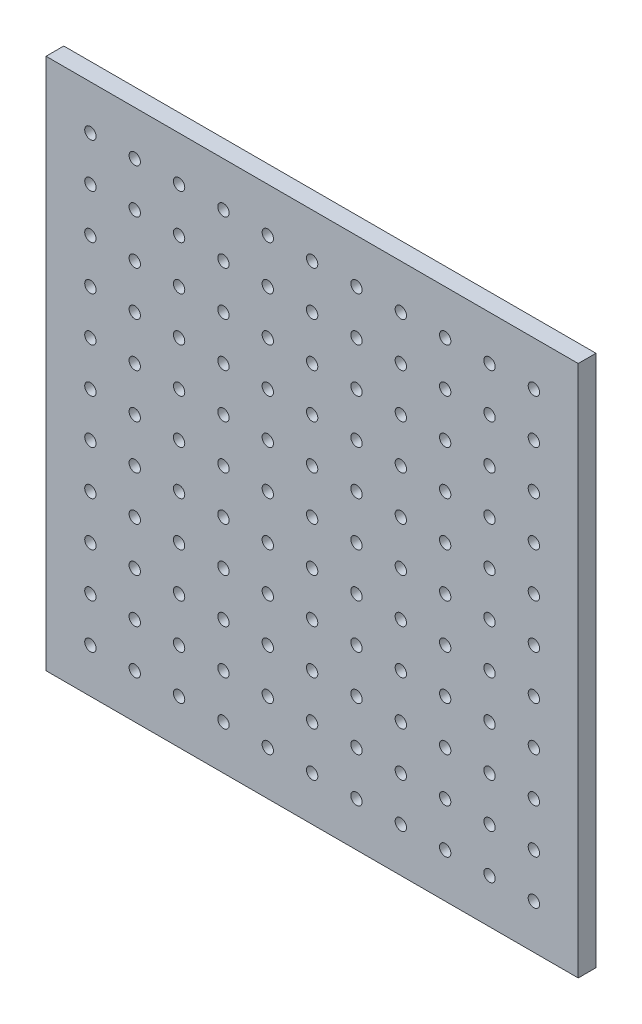
from build123d import *

# Parameters (mm, degrees)
SKETCH_1_W                         = 300
SKETCH_1_H                         = 300
EXTRUDE_1_DEPTH                    = 10
SKETCH_2_R                         = 3.2
CUT_EXTRUDE_1_DEPTH                = 213.367605816
PATTERN_LINEAR_1_COUNT             = 11
PATTERN_LINEAR_1_PITCH             = 25
PATTERN_LINEAR_2_COUNT             = 11
PATTERN_LINEAR_2_PITCH             = 25
PATTERN_LINEAR_2_COPY_1_SKETCH_R   = 3.2
PATTERN_LINEAR_2_COPY_1_DEPTH      = 213.367605816
PATTERN_LINEAR_2_COPY_2_SKETCH_R   = 3.2
PATTERN_LINEAR_2_COPY_2_DEPTH      = 213.367605816
PATTERN_LINEAR_2_COPY_3_SKETCH_R   = 3.2
PATTERN_LINEAR_2_COPY_3_DEPTH      = 213.367605816
PATTERN_LINEAR_2_COPY_4_SKETCH_R   = 3.2
PATTERN_LINEAR_2_COPY_4_DEPTH      = 213.367605816
PATTERN_LINEAR_2_COPY_5_SKETCH_R   = 3.2
PATTERN_LINEAR_2_COPY_5_DEPTH      = 213.367605816
PATTERN_LINEAR_2_COPY_6_SKETCH_R   = 3.2
PATTERN_LINEAR_2_COPY_6_DEPTH      = 213.367605816
PATTERN_LINEAR_2_COPY_7_SKETCH_R   = 3.2
PATTERN_LINEAR_2_COPY_7_DEPTH      = 213.367605816
PATTERN_LINEAR_2_COPY_8_SKETCH_R   = 3.2
PATTERN_LINEAR_2_COPY_8_DEPTH      = 213.367605816
PATTERN_LINEAR_2_COPY_9_SKETCH_R   = 3.2
PATTERN_LINEAR_2_COPY_9_DEPTH      = 213.367605816
PATTERN_LINEAR_2_COPY_10_SKETCH_R  = 3.2
PATTERN_LINEAR_2_COPY_10_DEPTH     = 213.367605816
PATTERN_LINEAR_2_COPY_11_SKETCH_R  = 3.2
PATTERN_LINEAR_2_COPY_11_DEPTH     = 213.367605816
PATTERN_LINEAR_2_COPY_12_SKETCH_R  = 3.2
PATTERN_LINEAR_2_COPY_12_DEPTH     = 213.367605816
PATTERN_LINEAR_2_COPY_13_SKETCH_R  = 3.2
PATTERN_LINEAR_2_COPY_13_DEPTH     = 213.367605816
PATTERN_LINEAR_2_COPY_14_SKETCH_R  = 3.2
PATTERN_LINEAR_2_COPY_14_DEPTH     = 213.367605816
PATTERN_LINEAR_2_COPY_15_SKETCH_R  = 3.2
PATTERN_LINEAR_2_COPY_15_DEPTH     = 213.367605816
PATTERN_LINEAR_2_COPY_16_SKETCH_R  = 3.2
PATTERN_LINEAR_2_COPY_16_DEPTH     = 213.367605816
PATTERN_LINEAR_2_COPY_17_SKETCH_R  = 3.2
PATTERN_LINEAR_2_COPY_17_DEPTH     = 213.367605816
PATTERN_LINEAR_2_COPY_18_SKETCH_R  = 3.2
PATTERN_LINEAR_2_COPY_18_DEPTH     = 213.367605816
PATTERN_LINEAR_2_COPY_19_SKETCH_R  = 3.2
PATTERN_LINEAR_2_COPY_19_DEPTH     = 213.367605816
PATTERN_LINEAR_2_COPY_20_SKETCH_R  = 3.2
PATTERN_LINEAR_2_COPY_20_DEPTH     = 213.367605816
PATTERN_LINEAR_2_COPY_21_SKETCH_R  = 3.2
PATTERN_LINEAR_2_COPY_21_DEPTH     = 213.367605816
PATTERN_LINEAR_2_COPY_22_SKETCH_R  = 3.2
PATTERN_LINEAR_2_COPY_22_DEPTH     = 213.367605816
PATTERN_LINEAR_2_COPY_23_SKETCH_R  = 3.2
PATTERN_LINEAR_2_COPY_23_DEPTH     = 213.367605816
PATTERN_LINEAR_2_COPY_24_SKETCH_R  = 3.2
PATTERN_LINEAR_2_COPY_24_DEPTH     = 213.367605816
PATTERN_LINEAR_2_COPY_25_SKETCH_R  = 3.2
PATTERN_LINEAR_2_COPY_25_DEPTH     = 213.367605816
PATTERN_LINEAR_2_COPY_26_SKETCH_R  = 3.2
PATTERN_LINEAR_2_COPY_26_DEPTH     = 213.367605816
PATTERN_LINEAR_2_COPY_27_SKETCH_R  = 3.2
PATTERN_LINEAR_2_COPY_27_DEPTH     = 213.367605816
PATTERN_LINEAR_2_COPY_28_SKETCH_R  = 3.2
PATTERN_LINEAR_2_COPY_28_DEPTH     = 213.367605816
PATTERN_LINEAR_2_COPY_29_SKETCH_R  = 3.2
PATTERN_LINEAR_2_COPY_29_DEPTH     = 213.367605816
PATTERN_LINEAR_2_COPY_30_SKETCH_R  = 3.2
PATTERN_LINEAR_2_COPY_30_DEPTH     = 213.367605816
PATTERN_LINEAR_2_COPY_31_SKETCH_R  = 3.2
PATTERN_LINEAR_2_COPY_31_DEPTH     = 213.367605816
PATTERN_LINEAR_2_COPY_32_SKETCH_R  = 3.2
PATTERN_LINEAR_2_COPY_32_DEPTH     = 213.367605816
PATTERN_LINEAR_2_COPY_33_SKETCH_R  = 3.2
PATTERN_LINEAR_2_COPY_33_DEPTH     = 213.367605816
PATTERN_LINEAR_2_COPY_34_SKETCH_R  = 3.2
PATTERN_LINEAR_2_COPY_34_DEPTH     = 213.367605816
PATTERN_LINEAR_2_COPY_35_SKETCH_R  = 3.2
PATTERN_LINEAR_2_COPY_35_DEPTH     = 213.367605816
PATTERN_LINEAR_2_COPY_36_SKETCH_R  = 3.2
PATTERN_LINEAR_2_COPY_36_DEPTH     = 213.367605816
PATTERN_LINEAR_2_COPY_37_SKETCH_R  = 3.2
PATTERN_LINEAR_2_COPY_37_DEPTH     = 213.367605816
PATTERN_LINEAR_2_COPY_38_SKETCH_R  = 3.2
PATTERN_LINEAR_2_COPY_38_DEPTH     = 213.367605816
PATTERN_LINEAR_2_COPY_39_SKETCH_R  = 3.2
PATTERN_LINEAR_2_COPY_39_DEPTH     = 213.367605816
PATTERN_LINEAR_2_COPY_40_SKETCH_R  = 3.2
PATTERN_LINEAR_2_COPY_40_DEPTH     = 213.367605816
PATTERN_LINEAR_2_COPY_41_SKETCH_R  = 3.2
PATTERN_LINEAR_2_COPY_41_DEPTH     = 213.367605816
PATTERN_LINEAR_2_COPY_42_SKETCH_R  = 3.2
PATTERN_LINEAR_2_COPY_42_DEPTH     = 213.367605816
PATTERN_LINEAR_2_COPY_43_SKETCH_R  = 3.2
PATTERN_LINEAR_2_COPY_43_DEPTH     = 213.367605816
PATTERN_LINEAR_2_COPY_44_SKETCH_R  = 3.2
PATTERN_LINEAR_2_COPY_44_DEPTH     = 213.367605816
PATTERN_LINEAR_2_COPY_45_SKETCH_R  = 3.2
PATTERN_LINEAR_2_COPY_45_DEPTH     = 213.367605816
PATTERN_LINEAR_2_COPY_46_SKETCH_R  = 3.2
PATTERN_LINEAR_2_COPY_46_DEPTH     = 213.367605816
PATTERN_LINEAR_2_COPY_47_SKETCH_R  = 3.2
PATTERN_LINEAR_2_COPY_47_DEPTH     = 213.367605816
PATTERN_LINEAR_2_COPY_48_SKETCH_R  = 3.2
PATTERN_LINEAR_2_COPY_48_DEPTH     = 213.367605816
PATTERN_LINEAR_2_COPY_49_SKETCH_R  = 3.2
PATTERN_LINEAR_2_COPY_49_DEPTH     = 213.367605816
PATTERN_LINEAR_2_COPY_50_SKETCH_R  = 3.2
PATTERN_LINEAR_2_COPY_50_DEPTH     = 213.367605816
PATTERN_LINEAR_2_COPY_51_SKETCH_R  = 3.2
PATTERN_LINEAR_2_COPY_51_DEPTH     = 213.367605816
PATTERN_LINEAR_2_COPY_52_SKETCH_R  = 3.2
PATTERN_LINEAR_2_COPY_52_DEPTH     = 213.367605816
PATTERN_LINEAR_2_COPY_53_SKETCH_R  = 3.2
PATTERN_LINEAR_2_COPY_53_DEPTH     = 213.367605816
PATTERN_LINEAR_2_COPY_54_SKETCH_R  = 3.2
PATTERN_LINEAR_2_COPY_54_DEPTH     = 213.367605816
PATTERN_LINEAR_2_COPY_55_SKETCH_R  = 3.2
PATTERN_LINEAR_2_COPY_55_DEPTH     = 213.367605816
PATTERN_LINEAR_2_COPY_56_SKETCH_R  = 3.2
PATTERN_LINEAR_2_COPY_56_DEPTH     = 213.367605816
PATTERN_LINEAR_2_COPY_57_SKETCH_R  = 3.2
PATTERN_LINEAR_2_COPY_57_DEPTH     = 213.367605816
PATTERN_LINEAR_2_COPY_58_SKETCH_R  = 3.2
PATTERN_LINEAR_2_COPY_58_DEPTH     = 213.367605816
PATTERN_LINEAR_2_COPY_59_SKETCH_R  = 3.2
PATTERN_LINEAR_2_COPY_59_DEPTH     = 213.367605816
PATTERN_LINEAR_2_COPY_60_SKETCH_R  = 3.2
PATTERN_LINEAR_2_COPY_60_DEPTH     = 213.367605816
PATTERN_LINEAR_2_COPY_61_SKETCH_R  = 3.2
PATTERN_LINEAR_2_COPY_61_DEPTH     = 213.367605816
PATTERN_LINEAR_2_COPY_62_SKETCH_R  = 3.2
PATTERN_LINEAR_2_COPY_62_DEPTH     = 213.367605816
PATTERN_LINEAR_2_COPY_63_SKETCH_R  = 3.2
PATTERN_LINEAR_2_COPY_63_DEPTH     = 213.367605816
PATTERN_LINEAR_2_COPY_64_SKETCH_R  = 3.2
PATTERN_LINEAR_2_COPY_64_DEPTH     = 213.367605816
PATTERN_LINEAR_2_COPY_65_SKETCH_R  = 3.2
PATTERN_LINEAR_2_COPY_65_DEPTH     = 213.367605816
PATTERN_LINEAR_2_COPY_66_SKETCH_R  = 3.2
PATTERN_LINEAR_2_COPY_66_DEPTH     = 213.367605816
PATTERN_LINEAR_2_COPY_67_SKETCH_R  = 3.2
PATTERN_LINEAR_2_COPY_67_DEPTH     = 213.367605816
PATTERN_LINEAR_2_COPY_68_SKETCH_R  = 3.2
PATTERN_LINEAR_2_COPY_68_DEPTH     = 213.367605816
PATTERN_LINEAR_2_COPY_69_SKETCH_R  = 3.2
PATTERN_LINEAR_2_COPY_69_DEPTH     = 213.367605816
PATTERN_LINEAR_2_COPY_70_SKETCH_R  = 3.2
PATTERN_LINEAR_2_COPY_70_DEPTH     = 213.367605816
PATTERN_LINEAR_2_COPY_71_SKETCH_R  = 3.2
PATTERN_LINEAR_2_COPY_71_DEPTH     = 213.367605816
PATTERN_LINEAR_2_COPY_72_SKETCH_R  = 3.2
PATTERN_LINEAR_2_COPY_72_DEPTH     = 213.367605816
PATTERN_LINEAR_2_COPY_73_SKETCH_R  = 3.2
PATTERN_LINEAR_2_COPY_73_DEPTH     = 213.367605816
PATTERN_LINEAR_2_COPY_74_SKETCH_R  = 3.2
PATTERN_LINEAR_2_COPY_74_DEPTH     = 213.367605816
PATTERN_LINEAR_2_COPY_75_SKETCH_R  = 3.2
PATTERN_LINEAR_2_COPY_75_DEPTH     = 213.367605816
PATTERN_LINEAR_2_COPY_76_SKETCH_R  = 3.2
PATTERN_LINEAR_2_COPY_76_DEPTH     = 213.367605816
PATTERN_LINEAR_2_COPY_77_SKETCH_R  = 3.2
PATTERN_LINEAR_2_COPY_77_DEPTH     = 213.367605816
PATTERN_LINEAR_2_COPY_78_SKETCH_R  = 3.2
PATTERN_LINEAR_2_COPY_78_DEPTH     = 213.367605816
PATTERN_LINEAR_2_COPY_79_SKETCH_R  = 3.2
PATTERN_LINEAR_2_COPY_79_DEPTH     = 213.367605816
PATTERN_LINEAR_2_COPY_80_SKETCH_R  = 3.2
PATTERN_LINEAR_2_COPY_80_DEPTH     = 213.367605816
PATTERN_LINEAR_2_COPY_81_SKETCH_R  = 3.2
PATTERN_LINEAR_2_COPY_81_DEPTH     = 213.367605816
PATTERN_LINEAR_2_COPY_82_SKETCH_R  = 3.2
PATTERN_LINEAR_2_COPY_82_DEPTH     = 213.367605816
PATTERN_LINEAR_2_COPY_83_SKETCH_R  = 3.2
PATTERN_LINEAR_2_COPY_83_DEPTH     = 213.367605816
PATTERN_LINEAR_2_COPY_84_SKETCH_R  = 3.2
PATTERN_LINEAR_2_COPY_84_DEPTH     = 213.367605816
PATTERN_LINEAR_2_COPY_85_SKETCH_R  = 3.2
PATTERN_LINEAR_2_COPY_85_DEPTH     = 213.367605816
PATTERN_LINEAR_2_COPY_86_SKETCH_R  = 3.2
PATTERN_LINEAR_2_COPY_86_DEPTH     = 213.367605816
PATTERN_LINEAR_2_COPY_87_SKETCH_R  = 3.2
PATTERN_LINEAR_2_COPY_87_DEPTH     = 213.367605816
PATTERN_LINEAR_2_COPY_88_SKETCH_R  = 3.2
PATTERN_LINEAR_2_COPY_88_DEPTH     = 213.367605816
PATTERN_LINEAR_2_COPY_89_SKETCH_R  = 3.2
PATTERN_LINEAR_2_COPY_89_DEPTH     = 213.367605816
PATTERN_LINEAR_2_COPY_90_SKETCH_R  = 3.2
PATTERN_LINEAR_2_COPY_90_DEPTH     = 213.367605816
PATTERN_LINEAR_2_COPY_91_SKETCH_R  = 3.2
PATTERN_LINEAR_2_COPY_91_DEPTH     = 213.367605816
PATTERN_LINEAR_2_COPY_92_SKETCH_R  = 3.2
PATTERN_LINEAR_2_COPY_92_DEPTH     = 213.367605816
PATTERN_LINEAR_2_COPY_93_SKETCH_R  = 3.2
PATTERN_LINEAR_2_COPY_93_DEPTH     = 213.367605816
PATTERN_LINEAR_2_COPY_94_SKETCH_R  = 3.2
PATTERN_LINEAR_2_COPY_94_DEPTH     = 213.367605816
PATTERN_LINEAR_2_COPY_95_SKETCH_R  = 3.2
PATTERN_LINEAR_2_COPY_95_DEPTH     = 213.367605816
PATTERN_LINEAR_2_COPY_96_SKETCH_R  = 3.2
PATTERN_LINEAR_2_COPY_96_DEPTH     = 213.367605816
PATTERN_LINEAR_2_COPY_97_SKETCH_R  = 3.2
PATTERN_LINEAR_2_COPY_97_DEPTH     = 213.367605816
PATTERN_LINEAR_2_COPY_98_SKETCH_R  = 3.2
PATTERN_LINEAR_2_COPY_98_DEPTH     = 213.367605816
PATTERN_LINEAR_2_COPY_99_SKETCH_R  = 3.2
PATTERN_LINEAR_2_COPY_99_DEPTH     = 213.367605816
PATTERN_LINEAR_2_COPY_100_SKETCH_R = 3.2
PATTERN_LINEAR_2_COPY_100_DEPTH    = 213.367605816


with BuildPart() as part:
    # 스케치1 → 보스-돌출1 (new body)
    with BuildSketch(Plane.XY):
        Rectangle(SKETCH_1_W, SKETCH_1_H)
    extrude(amount=EXTRUDE_1_DEPTH)

    # 스케치2 → 컷-돌출1 (cut, through all)
    with BuildSketch(Plane.XY.offset(10)):
        with Locations((-125, 125)):
            Circle(SKETCH_2_R)
    cut_extrude_1 = extrude(amount=-CUT_EXTRUDE_1_DEPTH, mode=Mode.SUBTRACT)

    # 선형 패턴1: 컷-돌출1 ×11
    with Locations(*[(i * PATTERN_LINEAR_1_PITCH, 0, 0) for i in range(1, PATTERN_LINEAR_1_COUNT)]):
        add(cut_extrude_1, mode=Mode.SUBTRACT)

    # 선형 패턴2: 컷-돌출1 ×11
    with Locations(*[(0, -i * PATTERN_LINEAR_2_PITCH, 0) for i in range(1, PATTERN_LINEAR_2_COUNT)]):
        add(cut_extrude_1, mode=Mode.SUBTRACT)

    # 선형 패턴2 copy 1 sketch → 선형 패턴2 copy 1 (cut, through all)
    with BuildSketch(Plane(origin=(25, -25, 10), x_dir=(1, 0, 0), z_dir=(0, 0, 1))):
        with Locations((-125, 125)):
            Circle(PATTERN_LINEAR_2_COPY_1_SKETCH_R)
    extrude(amount=-PATTERN_LINEAR_2_COPY_1_DEPTH, mode=Mode.SUBTRACT)

    # 선형 패턴2 copy 2 sketch → 선형 패턴2 copy 2 (cut, through all)
    with BuildSketch(Plane(origin=(25, -50, 10), x_dir=(1, 0, 0), z_dir=(0, 0, 1))):
        with Locations((-125, 125)):
            Circle(PATTERN_LINEAR_2_COPY_2_SKETCH_R)
    extrude(amount=-PATTERN_LINEAR_2_COPY_2_DEPTH, mode=Mode.SUBTRACT)

    # 선형 패턴2 copy 3 sketch → 선형 패턴2 copy 3 (cut, through all)
    with BuildSketch(Plane(origin=(25, -75, 10), x_dir=(1, 0, 0), z_dir=(0, 0, 1))):
        with Locations((-125, 125)):
            Circle(PATTERN_LINEAR_2_COPY_3_SKETCH_R)
    extrude(amount=-PATTERN_LINEAR_2_COPY_3_DEPTH, mode=Mode.SUBTRACT)

    # 선형 패턴2 copy 4 sketch → 선형 패턴2 copy 4 (cut, through all)
    with BuildSketch(Plane(origin=(25, -100, 10), x_dir=(1, 0, 0), z_dir=(0, 0, 1))):
        with Locations((-125, 125)):
            Circle(PATTERN_LINEAR_2_COPY_4_SKETCH_R)
    extrude(amount=-PATTERN_LINEAR_2_COPY_4_DEPTH, mode=Mode.SUBTRACT)

    # 선형 패턴2 copy 5 sketch → 선형 패턴2 copy 5 (cut, through all)
    with BuildSketch(Plane(origin=(25, -125, 10), x_dir=(1, 0, 0), z_dir=(0, 0, 1))):
        with Locations((-125, 125)):
            Circle(PATTERN_LINEAR_2_COPY_5_SKETCH_R)
    extrude(amount=-PATTERN_LINEAR_2_COPY_5_DEPTH, mode=Mode.SUBTRACT)

    # 선형 패턴2 copy 6 sketch → 선형 패턴2 copy 6 (cut, through all)
    with BuildSketch(Plane(origin=(25, -150, 10), x_dir=(1, 0, 0), z_dir=(0, 0, 1))):
        with Locations((-125, 125)):
            Circle(PATTERN_LINEAR_2_COPY_6_SKETCH_R)
    extrude(amount=-PATTERN_LINEAR_2_COPY_6_DEPTH, mode=Mode.SUBTRACT)

    # 선형 패턴2 copy 7 sketch → 선형 패턴2 copy 7 (cut, through all)
    with BuildSketch(Plane(origin=(25, -175, 10), x_dir=(1, 0, 0), z_dir=(0, 0, 1))):
        with Locations((-125, 125)):
            Circle(PATTERN_LINEAR_2_COPY_7_SKETCH_R)
    extrude(amount=-PATTERN_LINEAR_2_COPY_7_DEPTH, mode=Mode.SUBTRACT)

    # 선형 패턴2 copy 8 sketch → 선형 패턴2 copy 8 (cut, through all)
    with BuildSketch(Plane(origin=(25, -200, 10), x_dir=(1, 0, 0), z_dir=(0, 0, 1))):
        with Locations((-125, 125)):
            Circle(PATTERN_LINEAR_2_COPY_8_SKETCH_R)
    extrude(amount=-PATTERN_LINEAR_2_COPY_8_DEPTH, mode=Mode.SUBTRACT)

    # 선형 패턴2 copy 9 sketch → 선형 패턴2 copy 9 (cut, through all)
    with BuildSketch(Plane(origin=(25, -225, 10), x_dir=(1, 0, 0), z_dir=(0, 0, 1))):
        with Locations((-125, 125)):
            Circle(PATTERN_LINEAR_2_COPY_9_SKETCH_R)
    extrude(amount=-PATTERN_LINEAR_2_COPY_9_DEPTH, mode=Mode.SUBTRACT)

    # 선형 패턴2 copy 10 sketch → 선형 패턴2 copy 10 (cut, through all)
    with BuildSketch(Plane(origin=(25, -250, 10), x_dir=(1, 0, 0), z_dir=(0, 0, 1))):
        with Locations((-125, 125)):
            Circle(PATTERN_LINEAR_2_COPY_10_SKETCH_R)
    extrude(amount=-PATTERN_LINEAR_2_COPY_10_DEPTH, mode=Mode.SUBTRACT)

    # 선형 패턴2 copy 11 sketch → 선형 패턴2 copy 11 (cut, through all)
    with BuildSketch(Plane(origin=(50, -25, 10), x_dir=(1, 0, 0), z_dir=(0, 0, 1))):
        with Locations((-125, 125)):
            Circle(PATTERN_LINEAR_2_COPY_11_SKETCH_R)
    extrude(amount=-PATTERN_LINEAR_2_COPY_11_DEPTH, mode=Mode.SUBTRACT)

    # 선형 패턴2 copy 12 sketch → 선형 패턴2 copy 12 (cut, through all)
    with BuildSketch(Plane(origin=(50, -50, 10), x_dir=(1, 0, 0), z_dir=(0, 0, 1))):
        with Locations((-125, 125)):
            Circle(PATTERN_LINEAR_2_COPY_12_SKETCH_R)
    extrude(amount=-PATTERN_LINEAR_2_COPY_12_DEPTH, mode=Mode.SUBTRACT)

    # 선형 패턴2 copy 13 sketch → 선형 패턴2 copy 13 (cut, through all)
    with BuildSketch(Plane(origin=(50, -75, 10), x_dir=(1, 0, 0), z_dir=(0, 0, 1))):
        with Locations((-125, 125)):
            Circle(PATTERN_LINEAR_2_COPY_13_SKETCH_R)
    extrude(amount=-PATTERN_LINEAR_2_COPY_13_DEPTH, mode=Mode.SUBTRACT)

    # 선형 패턴2 copy 14 sketch → 선형 패턴2 copy 14 (cut, through all)
    with BuildSketch(Plane(origin=(50, -100, 10), x_dir=(1, 0, 0), z_dir=(0, 0, 1))):
        with Locations((-125, 125)):
            Circle(PATTERN_LINEAR_2_COPY_14_SKETCH_R)
    extrude(amount=-PATTERN_LINEAR_2_COPY_14_DEPTH, mode=Mode.SUBTRACT)

    # 선형 패턴2 copy 15 sketch → 선형 패턴2 copy 15 (cut, through all)
    with BuildSketch(Plane(origin=(50, -125, 10), x_dir=(1, 0, 0), z_dir=(0, 0, 1))):
        with Locations((-125, 125)):
            Circle(PATTERN_LINEAR_2_COPY_15_SKETCH_R)
    extrude(amount=-PATTERN_LINEAR_2_COPY_15_DEPTH, mode=Mode.SUBTRACT)

    # 선형 패턴2 copy 16 sketch → 선형 패턴2 copy 16 (cut, through all)
    with BuildSketch(Plane(origin=(50, -150, 10), x_dir=(1, 0, 0), z_dir=(0, 0, 1))):
        with Locations((-125, 125)):
            Circle(PATTERN_LINEAR_2_COPY_16_SKETCH_R)
    extrude(amount=-PATTERN_LINEAR_2_COPY_16_DEPTH, mode=Mode.SUBTRACT)

    # 선형 패턴2 copy 17 sketch → 선형 패턴2 copy 17 (cut, through all)
    with BuildSketch(Plane(origin=(50, -175, 10), x_dir=(1, 0, 0), z_dir=(0, 0, 1))):
        with Locations((-125, 125)):
            Circle(PATTERN_LINEAR_2_COPY_17_SKETCH_R)
    extrude(amount=-PATTERN_LINEAR_2_COPY_17_DEPTH, mode=Mode.SUBTRACT)

    # 선형 패턴2 copy 18 sketch → 선형 패턴2 copy 18 (cut, through all)
    with BuildSketch(Plane(origin=(50, -200, 10), x_dir=(1, 0, 0), z_dir=(0, 0, 1))):
        with Locations((-125, 125)):
            Circle(PATTERN_LINEAR_2_COPY_18_SKETCH_R)
    extrude(amount=-PATTERN_LINEAR_2_COPY_18_DEPTH, mode=Mode.SUBTRACT)

    # 선형 패턴2 copy 19 sketch → 선형 패턴2 copy 19 (cut, through all)
    with BuildSketch(Plane(origin=(50, -225, 10), x_dir=(1, 0, 0), z_dir=(0, 0, 1))):
        with Locations((-125, 125)):
            Circle(PATTERN_LINEAR_2_COPY_19_SKETCH_R)
    extrude(amount=-PATTERN_LINEAR_2_COPY_19_DEPTH, mode=Mode.SUBTRACT)

    # 선형 패턴2 copy 20 sketch → 선형 패턴2 copy 20 (cut, through all)
    with BuildSketch(Plane(origin=(50, -250, 10), x_dir=(1, 0, 0), z_dir=(0, 0, 1))):
        with Locations((-125, 125)):
            Circle(PATTERN_LINEAR_2_COPY_20_SKETCH_R)
    extrude(amount=-PATTERN_LINEAR_2_COPY_20_DEPTH, mode=Mode.SUBTRACT)

    # 선형 패턴2 copy 21 sketch → 선형 패턴2 copy 21 (cut, through all)
    with BuildSketch(Plane(origin=(75, -25, 10), x_dir=(1, 0, 0), z_dir=(0, 0, 1))):
        with Locations((-125, 125)):
            Circle(PATTERN_LINEAR_2_COPY_21_SKETCH_R)
    extrude(amount=-PATTERN_LINEAR_2_COPY_21_DEPTH, mode=Mode.SUBTRACT)

    # 선형 패턴2 copy 22 sketch → 선형 패턴2 copy 22 (cut, through all)
    with BuildSketch(Plane(origin=(75, -50, 10), x_dir=(1, 0, 0), z_dir=(0, 0, 1))):
        with Locations((-125, 125)):
            Circle(PATTERN_LINEAR_2_COPY_22_SKETCH_R)
    extrude(amount=-PATTERN_LINEAR_2_COPY_22_DEPTH, mode=Mode.SUBTRACT)

    # 선형 패턴2 copy 23 sketch → 선형 패턴2 copy 23 (cut, through all)
    with BuildSketch(Plane(origin=(75, -75, 10), x_dir=(1, 0, 0), z_dir=(0, 0, 1))):
        with Locations((-125, 125)):
            Circle(PATTERN_LINEAR_2_COPY_23_SKETCH_R)
    extrude(amount=-PATTERN_LINEAR_2_COPY_23_DEPTH, mode=Mode.SUBTRACT)

    # 선형 패턴2 copy 24 sketch → 선형 패턴2 copy 24 (cut, through all)
    with BuildSketch(Plane(origin=(75, -100, 10), x_dir=(1, 0, 0), z_dir=(0, 0, 1))):
        with Locations((-125, 125)):
            Circle(PATTERN_LINEAR_2_COPY_24_SKETCH_R)
    extrude(amount=-PATTERN_LINEAR_2_COPY_24_DEPTH, mode=Mode.SUBTRACT)

    # 선형 패턴2 copy 25 sketch → 선형 패턴2 copy 25 (cut, through all)
    with BuildSketch(Plane(origin=(75, -125, 10), x_dir=(1, 0, 0), z_dir=(0, 0, 1))):
        with Locations((-125, 125)):
            Circle(PATTERN_LINEAR_2_COPY_25_SKETCH_R)
    extrude(amount=-PATTERN_LINEAR_2_COPY_25_DEPTH, mode=Mode.SUBTRACT)

    # 선형 패턴2 copy 26 sketch → 선형 패턴2 copy 26 (cut, through all)
    with BuildSketch(Plane(origin=(75, -150, 10), x_dir=(1, 0, 0), z_dir=(0, 0, 1))):
        with Locations((-125, 125)):
            Circle(PATTERN_LINEAR_2_COPY_26_SKETCH_R)
    extrude(amount=-PATTERN_LINEAR_2_COPY_26_DEPTH, mode=Mode.SUBTRACT)

    # 선형 패턴2 copy 27 sketch → 선형 패턴2 copy 27 (cut, through all)
    with BuildSketch(Plane(origin=(75, -175, 10), x_dir=(1, 0, 0), z_dir=(0, 0, 1))):
        with Locations((-125, 125)):
            Circle(PATTERN_LINEAR_2_COPY_27_SKETCH_R)
    extrude(amount=-PATTERN_LINEAR_2_COPY_27_DEPTH, mode=Mode.SUBTRACT)

    # 선형 패턴2 copy 28 sketch → 선형 패턴2 copy 28 (cut, through all)
    with BuildSketch(Plane(origin=(75, -200, 10), x_dir=(1, 0, 0), z_dir=(0, 0, 1))):
        with Locations((-125, 125)):
            Circle(PATTERN_LINEAR_2_COPY_28_SKETCH_R)
    extrude(amount=-PATTERN_LINEAR_2_COPY_28_DEPTH, mode=Mode.SUBTRACT)

    # 선형 패턴2 copy 29 sketch → 선형 패턴2 copy 29 (cut, through all)
    with BuildSketch(Plane(origin=(75, -225, 10), x_dir=(1, 0, 0), z_dir=(0, 0, 1))):
        with Locations((-125, 125)):
            Circle(PATTERN_LINEAR_2_COPY_29_SKETCH_R)
    extrude(amount=-PATTERN_LINEAR_2_COPY_29_DEPTH, mode=Mode.SUBTRACT)

    # 선형 패턴2 copy 30 sketch → 선형 패턴2 copy 30 (cut, through all)
    with BuildSketch(Plane(origin=(75, -250, 10), x_dir=(1, 0, 0), z_dir=(0, 0, 1))):
        with Locations((-125, 125)):
            Circle(PATTERN_LINEAR_2_COPY_30_SKETCH_R)
    extrude(amount=-PATTERN_LINEAR_2_COPY_30_DEPTH, mode=Mode.SUBTRACT)

    # 선형 패턴2 copy 31 sketch → 선형 패턴2 copy 31 (cut, through all)
    with BuildSketch(Plane(origin=(100, -25, 10), x_dir=(1, 0, 0), z_dir=(0, 0, 1))):
        with Locations((-125, 125)):
            Circle(PATTERN_LINEAR_2_COPY_31_SKETCH_R)
    extrude(amount=-PATTERN_LINEAR_2_COPY_31_DEPTH, mode=Mode.SUBTRACT)

    # 선형 패턴2 copy 32 sketch → 선형 패턴2 copy 32 (cut, through all)
    with BuildSketch(Plane(origin=(100, -50, 10), x_dir=(1, 0, 0), z_dir=(0, 0, 1))):
        with Locations((-125, 125)):
            Circle(PATTERN_LINEAR_2_COPY_32_SKETCH_R)
    extrude(amount=-PATTERN_LINEAR_2_COPY_32_DEPTH, mode=Mode.SUBTRACT)

    # 선형 패턴2 copy 33 sketch → 선형 패턴2 copy 33 (cut, through all)
    with BuildSketch(Plane(origin=(100, -75, 10), x_dir=(1, 0, 0), z_dir=(0, 0, 1))):
        with Locations((-125, 125)):
            Circle(PATTERN_LINEAR_2_COPY_33_SKETCH_R)
    extrude(amount=-PATTERN_LINEAR_2_COPY_33_DEPTH, mode=Mode.SUBTRACT)

    # 선형 패턴2 copy 34 sketch → 선형 패턴2 copy 34 (cut, through all)
    with BuildSketch(Plane(origin=(100, -100, 10), x_dir=(1, 0, 0), z_dir=(0, 0, 1))):
        with Locations((-125, 125)):
            Circle(PATTERN_LINEAR_2_COPY_34_SKETCH_R)
    extrude(amount=-PATTERN_LINEAR_2_COPY_34_DEPTH, mode=Mode.SUBTRACT)

    # 선형 패턴2 copy 35 sketch → 선형 패턴2 copy 35 (cut, through all)
    with BuildSketch(Plane(origin=(100, -125, 10), x_dir=(1, 0, 0), z_dir=(0, 0, 1))):
        with Locations((-125, 125)):
            Circle(PATTERN_LINEAR_2_COPY_35_SKETCH_R)
    extrude(amount=-PATTERN_LINEAR_2_COPY_35_DEPTH, mode=Mode.SUBTRACT)

    # 선형 패턴2 copy 36 sketch → 선형 패턴2 copy 36 (cut, through all)
    with BuildSketch(Plane(origin=(100, -150, 10), x_dir=(1, 0, 0), z_dir=(0, 0, 1))):
        with Locations((-125, 125)):
            Circle(PATTERN_LINEAR_2_COPY_36_SKETCH_R)
    extrude(amount=-PATTERN_LINEAR_2_COPY_36_DEPTH, mode=Mode.SUBTRACT)

    # 선형 패턴2 copy 37 sketch → 선형 패턴2 copy 37 (cut, through all)
    with BuildSketch(Plane(origin=(100, -175, 10), x_dir=(1, 0, 0), z_dir=(0, 0, 1))):
        with Locations((-125, 125)):
            Circle(PATTERN_LINEAR_2_COPY_37_SKETCH_R)
    extrude(amount=-PATTERN_LINEAR_2_COPY_37_DEPTH, mode=Mode.SUBTRACT)

    # 선형 패턴2 copy 38 sketch → 선형 패턴2 copy 38 (cut, through all)
    with BuildSketch(Plane(origin=(100, -200, 10), x_dir=(1, 0, 0), z_dir=(0, 0, 1))):
        with Locations((-125, 125)):
            Circle(PATTERN_LINEAR_2_COPY_38_SKETCH_R)
    extrude(amount=-PATTERN_LINEAR_2_COPY_38_DEPTH, mode=Mode.SUBTRACT)

    # 선형 패턴2 copy 39 sketch → 선형 패턴2 copy 39 (cut, through all)
    with BuildSketch(Plane(origin=(100, -225, 10), x_dir=(1, 0, 0), z_dir=(0, 0, 1))):
        with Locations((-125, 125)):
            Circle(PATTERN_LINEAR_2_COPY_39_SKETCH_R)
    extrude(amount=-PATTERN_LINEAR_2_COPY_39_DEPTH, mode=Mode.SUBTRACT)

    # 선형 패턴2 copy 40 sketch → 선형 패턴2 copy 40 (cut, through all)
    with BuildSketch(Plane(origin=(100, -250, 10), x_dir=(1, 0, 0), z_dir=(0, 0, 1))):
        with Locations((-125, 125)):
            Circle(PATTERN_LINEAR_2_COPY_40_SKETCH_R)
    extrude(amount=-PATTERN_LINEAR_2_COPY_40_DEPTH, mode=Mode.SUBTRACT)

    # 선형 패턴2 copy 41 sketch → 선형 패턴2 copy 41 (cut, through all)
    with BuildSketch(Plane(origin=(125, -25, 10), x_dir=(1, 0, 0), z_dir=(0, 0, 1))):
        with Locations((-125, 125)):
            Circle(PATTERN_LINEAR_2_COPY_41_SKETCH_R)
    extrude(amount=-PATTERN_LINEAR_2_COPY_41_DEPTH, mode=Mode.SUBTRACT)

    # 선형 패턴2 copy 42 sketch → 선형 패턴2 copy 42 (cut, through all)
    with BuildSketch(Plane(origin=(125, -50, 10), x_dir=(1, 0, 0), z_dir=(0, 0, 1))):
        with Locations((-125, 125)):
            Circle(PATTERN_LINEAR_2_COPY_42_SKETCH_R)
    extrude(amount=-PATTERN_LINEAR_2_COPY_42_DEPTH, mode=Mode.SUBTRACT)

    # 선형 패턴2 copy 43 sketch → 선형 패턴2 copy 43 (cut, through all)
    with BuildSketch(Plane(origin=(125, -75, 10), x_dir=(1, 0, 0), z_dir=(0, 0, 1))):
        with Locations((-125, 125)):
            Circle(PATTERN_LINEAR_2_COPY_43_SKETCH_R)
    extrude(amount=-PATTERN_LINEAR_2_COPY_43_DEPTH, mode=Mode.SUBTRACT)

    # 선형 패턴2 copy 44 sketch → 선형 패턴2 copy 44 (cut, through all)
    with BuildSketch(Plane(origin=(125, -100, 10), x_dir=(1, 0, 0), z_dir=(0, 0, 1))):
        with Locations((-125, 125)):
            Circle(PATTERN_LINEAR_2_COPY_44_SKETCH_R)
    extrude(amount=-PATTERN_LINEAR_2_COPY_44_DEPTH, mode=Mode.SUBTRACT)

    # 선형 패턴2 copy 45 sketch → 선형 패턴2 copy 45 (cut, through all)
    with BuildSketch(Plane(origin=(125, -125, 10), x_dir=(1, 0, 0), z_dir=(0, 0, 1))):
        with Locations((-125, 125)):
            Circle(PATTERN_LINEAR_2_COPY_45_SKETCH_R)
    extrude(amount=-PATTERN_LINEAR_2_COPY_45_DEPTH, mode=Mode.SUBTRACT)

    # 선형 패턴2 copy 46 sketch → 선형 패턴2 copy 46 (cut, through all)
    with BuildSketch(Plane(origin=(125, -150, 10), x_dir=(1, 0, 0), z_dir=(0, 0, 1))):
        with Locations((-125, 125)):
            Circle(PATTERN_LINEAR_2_COPY_46_SKETCH_R)
    extrude(amount=-PATTERN_LINEAR_2_COPY_46_DEPTH, mode=Mode.SUBTRACT)

    # 선형 패턴2 copy 47 sketch → 선형 패턴2 copy 47 (cut, through all)
    with BuildSketch(Plane(origin=(125, -175, 10), x_dir=(1, 0, 0), z_dir=(0, 0, 1))):
        with Locations((-125, 125)):
            Circle(PATTERN_LINEAR_2_COPY_47_SKETCH_R)
    extrude(amount=-PATTERN_LINEAR_2_COPY_47_DEPTH, mode=Mode.SUBTRACT)

    # 선형 패턴2 copy 48 sketch → 선형 패턴2 copy 48 (cut, through all)
    with BuildSketch(Plane(origin=(125, -200, 10), x_dir=(1, 0, 0), z_dir=(0, 0, 1))):
        with Locations((-125, 125)):
            Circle(PATTERN_LINEAR_2_COPY_48_SKETCH_R)
    extrude(amount=-PATTERN_LINEAR_2_COPY_48_DEPTH, mode=Mode.SUBTRACT)

    # 선형 패턴2 copy 49 sketch → 선형 패턴2 copy 49 (cut, through all)
    with BuildSketch(Plane(origin=(125, -225, 10), x_dir=(1, 0, 0), z_dir=(0, 0, 1))):
        with Locations((-125, 125)):
            Circle(PATTERN_LINEAR_2_COPY_49_SKETCH_R)
    extrude(amount=-PATTERN_LINEAR_2_COPY_49_DEPTH, mode=Mode.SUBTRACT)

    # 선형 패턴2 copy 50 sketch → 선형 패턴2 copy 50 (cut, through all)
    with BuildSketch(Plane(origin=(125, -250, 10), x_dir=(1, 0, 0), z_dir=(0, 0, 1))):
        with Locations((-125, 125)):
            Circle(PATTERN_LINEAR_2_COPY_50_SKETCH_R)
    extrude(amount=-PATTERN_LINEAR_2_COPY_50_DEPTH, mode=Mode.SUBTRACT)

    # 선형 패턴2 copy 51 sketch → 선형 패턴2 copy 51 (cut, through all)
    with BuildSketch(Plane(origin=(150, -25, 10), x_dir=(1, 0, 0), z_dir=(0, 0, 1))):
        with Locations((-125, 125)):
            Circle(PATTERN_LINEAR_2_COPY_51_SKETCH_R)
    extrude(amount=-PATTERN_LINEAR_2_COPY_51_DEPTH, mode=Mode.SUBTRACT)

    # 선형 패턴2 copy 52 sketch → 선형 패턴2 copy 52 (cut, through all)
    with BuildSketch(Plane(origin=(150, -50, 10), x_dir=(1, 0, 0), z_dir=(0, 0, 1))):
        with Locations((-125, 125)):
            Circle(PATTERN_LINEAR_2_COPY_52_SKETCH_R)
    extrude(amount=-PATTERN_LINEAR_2_COPY_52_DEPTH, mode=Mode.SUBTRACT)

    # 선형 패턴2 copy 53 sketch → 선형 패턴2 copy 53 (cut, through all)
    with BuildSketch(Plane(origin=(150, -75, 10), x_dir=(1, 0, 0), z_dir=(0, 0, 1))):
        with Locations((-125, 125)):
            Circle(PATTERN_LINEAR_2_COPY_53_SKETCH_R)
    extrude(amount=-PATTERN_LINEAR_2_COPY_53_DEPTH, mode=Mode.SUBTRACT)

    # 선형 패턴2 copy 54 sketch → 선형 패턴2 copy 54 (cut, through all)
    with BuildSketch(Plane(origin=(150, -100, 10), x_dir=(1, 0, 0), z_dir=(0, 0, 1))):
        with Locations((-125, 125)):
            Circle(PATTERN_LINEAR_2_COPY_54_SKETCH_R)
    extrude(amount=-PATTERN_LINEAR_2_COPY_54_DEPTH, mode=Mode.SUBTRACT)

    # 선형 패턴2 copy 55 sketch → 선형 패턴2 copy 55 (cut, through all)
    with BuildSketch(Plane(origin=(150, -125, 10), x_dir=(1, 0, 0), z_dir=(0, 0, 1))):
        with Locations((-125, 125)):
            Circle(PATTERN_LINEAR_2_COPY_55_SKETCH_R)
    extrude(amount=-PATTERN_LINEAR_2_COPY_55_DEPTH, mode=Mode.SUBTRACT)

    # 선형 패턴2 copy 56 sketch → 선형 패턴2 copy 56 (cut, through all)
    with BuildSketch(Plane(origin=(150, -150, 10), x_dir=(1, 0, 0), z_dir=(0, 0, 1))):
        with Locations((-125, 125)):
            Circle(PATTERN_LINEAR_2_COPY_56_SKETCH_R)
    extrude(amount=-PATTERN_LINEAR_2_COPY_56_DEPTH, mode=Mode.SUBTRACT)

    # 선형 패턴2 copy 57 sketch → 선형 패턴2 copy 57 (cut, through all)
    with BuildSketch(Plane(origin=(150, -175, 10), x_dir=(1, 0, 0), z_dir=(0, 0, 1))):
        with Locations((-125, 125)):
            Circle(PATTERN_LINEAR_2_COPY_57_SKETCH_R)
    extrude(amount=-PATTERN_LINEAR_2_COPY_57_DEPTH, mode=Mode.SUBTRACT)

    # 선형 패턴2 copy 58 sketch → 선형 패턴2 copy 58 (cut, through all)
    with BuildSketch(Plane(origin=(150, -200, 10), x_dir=(1, 0, 0), z_dir=(0, 0, 1))):
        with Locations((-125, 125)):
            Circle(PATTERN_LINEAR_2_COPY_58_SKETCH_R)
    extrude(amount=-PATTERN_LINEAR_2_COPY_58_DEPTH, mode=Mode.SUBTRACT)

    # 선형 패턴2 copy 59 sketch → 선형 패턴2 copy 59 (cut, through all)
    with BuildSketch(Plane(origin=(150, -225, 10), x_dir=(1, 0, 0), z_dir=(0, 0, 1))):
        with Locations((-125, 125)):
            Circle(PATTERN_LINEAR_2_COPY_59_SKETCH_R)
    extrude(amount=-PATTERN_LINEAR_2_COPY_59_DEPTH, mode=Mode.SUBTRACT)

    # 선형 패턴2 copy 60 sketch → 선형 패턴2 copy 60 (cut, through all)
    with BuildSketch(Plane(origin=(150, -250, 10), x_dir=(1, 0, 0), z_dir=(0, 0, 1))):
        with Locations((-125, 125)):
            Circle(PATTERN_LINEAR_2_COPY_60_SKETCH_R)
    extrude(amount=-PATTERN_LINEAR_2_COPY_60_DEPTH, mode=Mode.SUBTRACT)

    # 선형 패턴2 copy 61 sketch → 선형 패턴2 copy 61 (cut, through all)
    with BuildSketch(Plane(origin=(175, -25, 10), x_dir=(1, 0, 0), z_dir=(0, 0, 1))):
        with Locations((-125, 125)):
            Circle(PATTERN_LINEAR_2_COPY_61_SKETCH_R)
    extrude(amount=-PATTERN_LINEAR_2_COPY_61_DEPTH, mode=Mode.SUBTRACT)

    # 선형 패턴2 copy 62 sketch → 선형 패턴2 copy 62 (cut, through all)
    with BuildSketch(Plane(origin=(175, -50, 10), x_dir=(1, 0, 0), z_dir=(0, 0, 1))):
        with Locations((-125, 125)):
            Circle(PATTERN_LINEAR_2_COPY_62_SKETCH_R)
    extrude(amount=-PATTERN_LINEAR_2_COPY_62_DEPTH, mode=Mode.SUBTRACT)

    # 선형 패턴2 copy 63 sketch → 선형 패턴2 copy 63 (cut, through all)
    with BuildSketch(Plane(origin=(175, -75, 10), x_dir=(1, 0, 0), z_dir=(0, 0, 1))):
        with Locations((-125, 125)):
            Circle(PATTERN_LINEAR_2_COPY_63_SKETCH_R)
    extrude(amount=-PATTERN_LINEAR_2_COPY_63_DEPTH, mode=Mode.SUBTRACT)

    # 선형 패턴2 copy 64 sketch → 선형 패턴2 copy 64 (cut, through all)
    with BuildSketch(Plane(origin=(175, -100, 10), x_dir=(1, 0, 0), z_dir=(0, 0, 1))):
        with Locations((-125, 125)):
            Circle(PATTERN_LINEAR_2_COPY_64_SKETCH_R)
    extrude(amount=-PATTERN_LINEAR_2_COPY_64_DEPTH, mode=Mode.SUBTRACT)

    # 선형 패턴2 copy 65 sketch → 선형 패턴2 copy 65 (cut, through all)
    with BuildSketch(Plane(origin=(175, -125, 10), x_dir=(1, 0, 0), z_dir=(0, 0, 1))):
        with Locations((-125, 125)):
            Circle(PATTERN_LINEAR_2_COPY_65_SKETCH_R)
    extrude(amount=-PATTERN_LINEAR_2_COPY_65_DEPTH, mode=Mode.SUBTRACT)

    # 선형 패턴2 copy 66 sketch → 선형 패턴2 copy 66 (cut, through all)
    with BuildSketch(Plane(origin=(175, -150, 10), x_dir=(1, 0, 0), z_dir=(0, 0, 1))):
        with Locations((-125, 125)):
            Circle(PATTERN_LINEAR_2_COPY_66_SKETCH_R)
    extrude(amount=-PATTERN_LINEAR_2_COPY_66_DEPTH, mode=Mode.SUBTRACT)

    # 선형 패턴2 copy 67 sketch → 선형 패턴2 copy 67 (cut, through all)
    with BuildSketch(Plane(origin=(175, -175, 10), x_dir=(1, 0, 0), z_dir=(0, 0, 1))):
        with Locations((-125, 125)):
            Circle(PATTERN_LINEAR_2_COPY_67_SKETCH_R)
    extrude(amount=-PATTERN_LINEAR_2_COPY_67_DEPTH, mode=Mode.SUBTRACT)

    # 선형 패턴2 copy 68 sketch → 선형 패턴2 copy 68 (cut, through all)
    with BuildSketch(Plane(origin=(175, -200, 10), x_dir=(1, 0, 0), z_dir=(0, 0, 1))):
        with Locations((-125, 125)):
            Circle(PATTERN_LINEAR_2_COPY_68_SKETCH_R)
    extrude(amount=-PATTERN_LINEAR_2_COPY_68_DEPTH, mode=Mode.SUBTRACT)

    # 선형 패턴2 copy 69 sketch → 선형 패턴2 copy 69 (cut, through all)
    with BuildSketch(Plane(origin=(175, -225, 10), x_dir=(1, 0, 0), z_dir=(0, 0, 1))):
        with Locations((-125, 125)):
            Circle(PATTERN_LINEAR_2_COPY_69_SKETCH_R)
    extrude(amount=-PATTERN_LINEAR_2_COPY_69_DEPTH, mode=Mode.SUBTRACT)

    # 선형 패턴2 copy 70 sketch → 선형 패턴2 copy 70 (cut, through all)
    with BuildSketch(Plane(origin=(175, -250, 10), x_dir=(1, 0, 0), z_dir=(0, 0, 1))):
        with Locations((-125, 125)):
            Circle(PATTERN_LINEAR_2_COPY_70_SKETCH_R)
    extrude(amount=-PATTERN_LINEAR_2_COPY_70_DEPTH, mode=Mode.SUBTRACT)

    # 선형 패턴2 copy 71 sketch → 선형 패턴2 copy 71 (cut, through all)
    with BuildSketch(Plane(origin=(200, -25, 10), x_dir=(1, 0, 0), z_dir=(0, 0, 1))):
        with Locations((-125, 125)):
            Circle(PATTERN_LINEAR_2_COPY_71_SKETCH_R)
    extrude(amount=-PATTERN_LINEAR_2_COPY_71_DEPTH, mode=Mode.SUBTRACT)

    # 선형 패턴2 copy 72 sketch → 선형 패턴2 copy 72 (cut, through all)
    with BuildSketch(Plane(origin=(200, -50, 10), x_dir=(1, 0, 0), z_dir=(0, 0, 1))):
        with Locations((-125, 125)):
            Circle(PATTERN_LINEAR_2_COPY_72_SKETCH_R)
    extrude(amount=-PATTERN_LINEAR_2_COPY_72_DEPTH, mode=Mode.SUBTRACT)

    # 선형 패턴2 copy 73 sketch → 선형 패턴2 copy 73 (cut, through all)
    with BuildSketch(Plane(origin=(200, -75, 10), x_dir=(1, 0, 0), z_dir=(0, 0, 1))):
        with Locations((-125, 125)):
            Circle(PATTERN_LINEAR_2_COPY_73_SKETCH_R)
    extrude(amount=-PATTERN_LINEAR_2_COPY_73_DEPTH, mode=Mode.SUBTRACT)

    # 선형 패턴2 copy 74 sketch → 선형 패턴2 copy 74 (cut, through all)
    with BuildSketch(Plane(origin=(200, -100, 10), x_dir=(1, 0, 0), z_dir=(0, 0, 1))):
        with Locations((-125, 125)):
            Circle(PATTERN_LINEAR_2_COPY_74_SKETCH_R)
    extrude(amount=-PATTERN_LINEAR_2_COPY_74_DEPTH, mode=Mode.SUBTRACT)

    # 선형 패턴2 copy 75 sketch → 선형 패턴2 copy 75 (cut, through all)
    with BuildSketch(Plane(origin=(200, -125, 10), x_dir=(1, 0, 0), z_dir=(0, 0, 1))):
        with Locations((-125, 125)):
            Circle(PATTERN_LINEAR_2_COPY_75_SKETCH_R)
    extrude(amount=-PATTERN_LINEAR_2_COPY_75_DEPTH, mode=Mode.SUBTRACT)

    # 선형 패턴2 copy 76 sketch → 선형 패턴2 copy 76 (cut, through all)
    with BuildSketch(Plane(origin=(200, -150, 10), x_dir=(1, 0, 0), z_dir=(0, 0, 1))):
        with Locations((-125, 125)):
            Circle(PATTERN_LINEAR_2_COPY_76_SKETCH_R)
    extrude(amount=-PATTERN_LINEAR_2_COPY_76_DEPTH, mode=Mode.SUBTRACT)

    # 선형 패턴2 copy 77 sketch → 선형 패턴2 copy 77 (cut, through all)
    with BuildSketch(Plane(origin=(200, -175, 10), x_dir=(1, 0, 0), z_dir=(0, 0, 1))):
        with Locations((-125, 125)):
            Circle(PATTERN_LINEAR_2_COPY_77_SKETCH_R)
    extrude(amount=-PATTERN_LINEAR_2_COPY_77_DEPTH, mode=Mode.SUBTRACT)

    # 선형 패턴2 copy 78 sketch → 선형 패턴2 copy 78 (cut, through all)
    with BuildSketch(Plane(origin=(200, -200, 10), x_dir=(1, 0, 0), z_dir=(0, 0, 1))):
        with Locations((-125, 125)):
            Circle(PATTERN_LINEAR_2_COPY_78_SKETCH_R)
    extrude(amount=-PATTERN_LINEAR_2_COPY_78_DEPTH, mode=Mode.SUBTRACT)

    # 선형 패턴2 copy 79 sketch → 선형 패턴2 copy 79 (cut, through all)
    with BuildSketch(Plane(origin=(200, -225, 10), x_dir=(1, 0, 0), z_dir=(0, 0, 1))):
        with Locations((-125, 125)):
            Circle(PATTERN_LINEAR_2_COPY_79_SKETCH_R)
    extrude(amount=-PATTERN_LINEAR_2_COPY_79_DEPTH, mode=Mode.SUBTRACT)

    # 선형 패턴2 copy 80 sketch → 선형 패턴2 copy 80 (cut, through all)
    with BuildSketch(Plane(origin=(200, -250, 10), x_dir=(1, 0, 0), z_dir=(0, 0, 1))):
        with Locations((-125, 125)):
            Circle(PATTERN_LINEAR_2_COPY_80_SKETCH_R)
    extrude(amount=-PATTERN_LINEAR_2_COPY_80_DEPTH, mode=Mode.SUBTRACT)

    # 선형 패턴2 copy 81 sketch → 선형 패턴2 copy 81 (cut, through all)
    with BuildSketch(Plane(origin=(225, -25, 10), x_dir=(1, 0, 0), z_dir=(0, 0, 1))):
        with Locations((-125, 125)):
            Circle(PATTERN_LINEAR_2_COPY_81_SKETCH_R)
    extrude(amount=-PATTERN_LINEAR_2_COPY_81_DEPTH, mode=Mode.SUBTRACT)

    # 선형 패턴2 copy 82 sketch → 선형 패턴2 copy 82 (cut, through all)
    with BuildSketch(Plane(origin=(225, -50, 10), x_dir=(1, 0, 0), z_dir=(0, 0, 1))):
        with Locations((-125, 125)):
            Circle(PATTERN_LINEAR_2_COPY_82_SKETCH_R)
    extrude(amount=-PATTERN_LINEAR_2_COPY_82_DEPTH, mode=Mode.SUBTRACT)

    # 선형 패턴2 copy 83 sketch → 선형 패턴2 copy 83 (cut, through all)
    with BuildSketch(Plane(origin=(225, -75, 10), x_dir=(1, 0, 0), z_dir=(0, 0, 1))):
        with Locations((-125, 125)):
            Circle(PATTERN_LINEAR_2_COPY_83_SKETCH_R)
    extrude(amount=-PATTERN_LINEAR_2_COPY_83_DEPTH, mode=Mode.SUBTRACT)

    # 선형 패턴2 copy 84 sketch → 선형 패턴2 copy 84 (cut, through all)
    with BuildSketch(Plane(origin=(225, -100, 10), x_dir=(1, 0, 0), z_dir=(0, 0, 1))):
        with Locations((-125, 125)):
            Circle(PATTERN_LINEAR_2_COPY_84_SKETCH_R)
    extrude(amount=-PATTERN_LINEAR_2_COPY_84_DEPTH, mode=Mode.SUBTRACT)

    # 선형 패턴2 copy 85 sketch → 선형 패턴2 copy 85 (cut, through all)
    with BuildSketch(Plane(origin=(225, -125, 10), x_dir=(1, 0, 0), z_dir=(0, 0, 1))):
        with Locations((-125, 125)):
            Circle(PATTERN_LINEAR_2_COPY_85_SKETCH_R)
    extrude(amount=-PATTERN_LINEAR_2_COPY_85_DEPTH, mode=Mode.SUBTRACT)

    # 선형 패턴2 copy 86 sketch → 선형 패턴2 copy 86 (cut, through all)
    with BuildSketch(Plane(origin=(225, -150, 10), x_dir=(1, 0, 0), z_dir=(0, 0, 1))):
        with Locations((-125, 125)):
            Circle(PATTERN_LINEAR_2_COPY_86_SKETCH_R)
    extrude(amount=-PATTERN_LINEAR_2_COPY_86_DEPTH, mode=Mode.SUBTRACT)

    # 선형 패턴2 copy 87 sketch → 선형 패턴2 copy 87 (cut, through all)
    with BuildSketch(Plane(origin=(225, -175, 10), x_dir=(1, 0, 0), z_dir=(0, 0, 1))):
        with Locations((-125, 125)):
            Circle(PATTERN_LINEAR_2_COPY_87_SKETCH_R)
    extrude(amount=-PATTERN_LINEAR_2_COPY_87_DEPTH, mode=Mode.SUBTRACT)

    # 선형 패턴2 copy 88 sketch → 선형 패턴2 copy 88 (cut, through all)
    with BuildSketch(Plane(origin=(225, -200, 10), x_dir=(1, 0, 0), z_dir=(0, 0, 1))):
        with Locations((-125, 125)):
            Circle(PATTERN_LINEAR_2_COPY_88_SKETCH_R)
    extrude(amount=-PATTERN_LINEAR_2_COPY_88_DEPTH, mode=Mode.SUBTRACT)

    # 선형 패턴2 copy 89 sketch → 선형 패턴2 copy 89 (cut, through all)
    with BuildSketch(Plane(origin=(225, -225, 10), x_dir=(1, 0, 0), z_dir=(0, 0, 1))):
        with Locations((-125, 125)):
            Circle(PATTERN_LINEAR_2_COPY_89_SKETCH_R)
    extrude(amount=-PATTERN_LINEAR_2_COPY_89_DEPTH, mode=Mode.SUBTRACT)

    # 선형 패턴2 copy 90 sketch → 선형 패턴2 copy 90 (cut, through all)
    with BuildSketch(Plane(origin=(225, -250, 10), x_dir=(1, 0, 0), z_dir=(0, 0, 1))):
        with Locations((-125, 125)):
            Circle(PATTERN_LINEAR_2_COPY_90_SKETCH_R)
    extrude(amount=-PATTERN_LINEAR_2_COPY_90_DEPTH, mode=Mode.SUBTRACT)

    # 선형 패턴2 copy 91 sketch → 선형 패턴2 copy 91 (cut, through all)
    with BuildSketch(Plane(origin=(250, -25, 10), x_dir=(1, 0, 0), z_dir=(0, 0, 1))):
        with Locations((-125, 125)):
            Circle(PATTERN_LINEAR_2_COPY_91_SKETCH_R)
    extrude(amount=-PATTERN_LINEAR_2_COPY_91_DEPTH, mode=Mode.SUBTRACT)

    # 선형 패턴2 copy 92 sketch → 선형 패턴2 copy 92 (cut, through all)
    with BuildSketch(Plane(origin=(250, -50, 10), x_dir=(1, 0, 0), z_dir=(0, 0, 1))):
        with Locations((-125, 125)):
            Circle(PATTERN_LINEAR_2_COPY_92_SKETCH_R)
    extrude(amount=-PATTERN_LINEAR_2_COPY_92_DEPTH, mode=Mode.SUBTRACT)

    # 선형 패턴2 copy 93 sketch → 선형 패턴2 copy 93 (cut, through all)
    with BuildSketch(Plane(origin=(250, -75, 10), x_dir=(1, 0, 0), z_dir=(0, 0, 1))):
        with Locations((-125, 125)):
            Circle(PATTERN_LINEAR_2_COPY_93_SKETCH_R)
    extrude(amount=-PATTERN_LINEAR_2_COPY_93_DEPTH, mode=Mode.SUBTRACT)

    # 선형 패턴2 copy 94 sketch → 선형 패턴2 copy 94 (cut, through all)
    with BuildSketch(Plane(origin=(250, -100, 10), x_dir=(1, 0, 0), z_dir=(0, 0, 1))):
        with Locations((-125, 125)):
            Circle(PATTERN_LINEAR_2_COPY_94_SKETCH_R)
    extrude(amount=-PATTERN_LINEAR_2_COPY_94_DEPTH, mode=Mode.SUBTRACT)

    # 선형 패턴2 copy 95 sketch → 선형 패턴2 copy 95 (cut, through all)
    with BuildSketch(Plane(origin=(250, -125, 10), x_dir=(1, 0, 0), z_dir=(0, 0, 1))):
        with Locations((-125, 125)):
            Circle(PATTERN_LINEAR_2_COPY_95_SKETCH_R)
    extrude(amount=-PATTERN_LINEAR_2_COPY_95_DEPTH, mode=Mode.SUBTRACT)

    # 선형 패턴2 copy 96 sketch → 선형 패턴2 copy 96 (cut, through all)
    with BuildSketch(Plane(origin=(250, -150, 10), x_dir=(1, 0, 0), z_dir=(0, 0, 1))):
        with Locations((-125, 125)):
            Circle(PATTERN_LINEAR_2_COPY_96_SKETCH_R)
    extrude(amount=-PATTERN_LINEAR_2_COPY_96_DEPTH, mode=Mode.SUBTRACT)

    # 선형 패턴2 copy 97 sketch → 선형 패턴2 copy 97 (cut, through all)
    with BuildSketch(Plane(origin=(250, -175, 10), x_dir=(1, 0, 0), z_dir=(0, 0, 1))):
        with Locations((-125, 125)):
            Circle(PATTERN_LINEAR_2_COPY_97_SKETCH_R)
    extrude(amount=-PATTERN_LINEAR_2_COPY_97_DEPTH, mode=Mode.SUBTRACT)

    # 선형 패턴2 copy 98 sketch → 선형 패턴2 copy 98 (cut, through all)
    with BuildSketch(Plane(origin=(250, -200, 10), x_dir=(1, 0, 0), z_dir=(0, 0, 1))):
        with Locations((-125, 125)):
            Circle(PATTERN_LINEAR_2_COPY_98_SKETCH_R)
    extrude(amount=-PATTERN_LINEAR_2_COPY_98_DEPTH, mode=Mode.SUBTRACT)

    # 선형 패턴2 copy 99 sketch → 선형 패턴2 copy 99 (cut, through all)
    with BuildSketch(Plane(origin=(250, -225, 10), x_dir=(1, 0, 0), z_dir=(0, 0, 1))):
        with Locations((-125, 125)):
            Circle(PATTERN_LINEAR_2_COPY_99_SKETCH_R)
    extrude(amount=-PATTERN_LINEAR_2_COPY_99_DEPTH, mode=Mode.SUBTRACT)

    # 선형 패턴2 copy 100 sketch → 선형 패턴2 copy 100 (cut, through all)
    with BuildSketch(Plane(origin=(250, -250, 10), x_dir=(1, 0, 0), z_dir=(0, 0, 1))):
        with Locations((-125, 125)):
            Circle(PATTERN_LINEAR_2_COPY_100_SKETCH_R)
    extrude(amount=-PATTERN_LINEAR_2_COPY_100_DEPTH, mode=Mode.SUBTRACT)


solid = part.part
